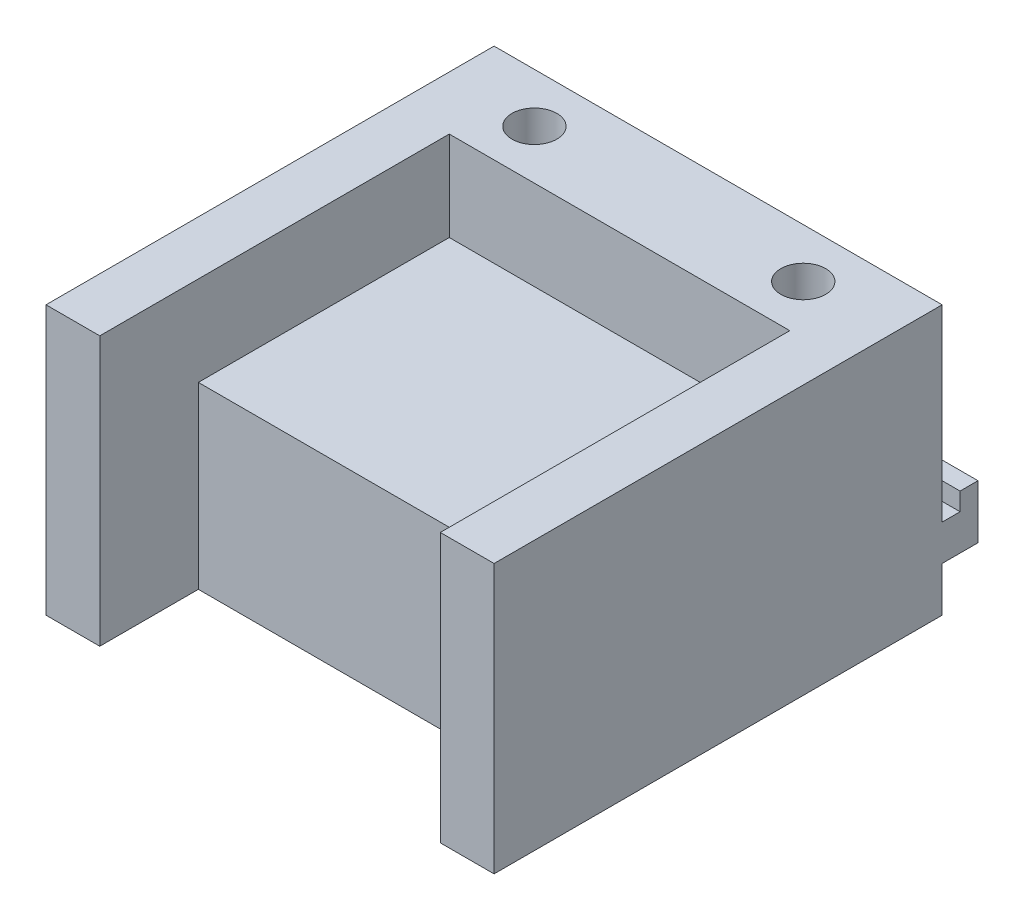
from build123d import *

# Parameters (mm, degrees)
SKETCH1_W                       = 25
SKETCH1_H                       = 25
BOSS_EXTRUDE1_DEPTH             = 15
SKETCH2_W                       = 19
SKETCH2_H                       = 14
CUT_EXTRUDE1_DEPTH              = 5
CUT_EXTRUDE2_DEPTH              = 24.184046239
CUT_EXTRUDE2_DEPTH_BACK         = 15
SKETCH3_W                       = 19
SKETCH3_H                       = 5.5
TAP_DRILL_FOR_M3X0_5_TAP1_D     = 2.5
TAP_DRILL_FOR_M3X0_5_TAP1_DEPTH = 5
TAP_DRILL_FOR_M3X0_5_TAP1_TIP   = 0.751075774
SKETCH6_W                       = 2
SKETCH6_H                       = 2
BOSS_EXTRUDE2_DEPTH             = 25
SKETCH7_W                       = 1
SKETCH7_H                       = 1
BOSS_EXTRUDE3_DEPTH             = 25


with BuildPart() as part:
    # Sketch1 → Boss-Extrude1 (new body)
    with BuildSketch(Plane(origin=(0, 0, 0), x_dir=(1, 0, 0), z_dir=(0, 1, 0))):
        Rectangle(SKETCH1_W, SKETCH1_H)
    extrude(amount=BOSS_EXTRUDE1_DEPTH)

    # Sketch2 → Cut-Extrude1 (cut)
    with BuildSketch(Plane(origin=(0, 15, 0), x_dir=(1, 0, 0), z_dir=(0, 1, 0))):
        Rectangle(SKETCH2_W, SKETCH2_H)
    extrude(amount=-CUT_EXTRUDE1_DEPTH, mode=Mode.SUBTRACT)

    # Sketch3 → Cut-Extrude2 (cut, two sides: drawn at the far end of the back side and taken through both)
    with BuildSketch(Plane(origin=(0, 15, 0), x_dir=(1, 0, 0), z_dir=(0, 1, 0)).offset(-CUT_EXTRUDE2_DEPTH_BACK)):
        with Locations((0, -9.75)):
            Rectangle(SKETCH3_W, SKETCH3_H)
    extrude(amount=CUT_EXTRUDE2_DEPTH + CUT_EXTRUDE2_DEPTH_BACK, mode=Mode.SUBTRACT)

    # Tap Drill for M3x0.5 Tap1
    with Locations(Plane(origin=(-7.5, 15, -9.75), x_dir=(0, 0, 1), z_dir=(0, 1, 0))):
        with Locations((0, 0), (0, 15)):
            Hole(TAP_DRILL_FOR_M3X0_5_TAP1_D / 2, depth=TAP_DRILL_FOR_M3X0_5_TAP1_DEPTH)
            with Locations((0, 0, -(TAP_DRILL_FOR_M3X0_5_TAP1_DEPTH + TAP_DRILL_FOR_M3X0_5_TAP1_TIP / 2))):  # 118° drill point
                Cone(0, TAP_DRILL_FOR_M3X0_5_TAP1_D / 2, TAP_DRILL_FOR_M3X0_5_TAP1_TIP, mode=Mode.SUBTRACT)

    # Sketch6 → Boss-Extrude2 (add)
    with BuildSketch(Plane(origin=(12.5, 0, 0), x_dir=(0, 0, -1), z_dir=(1, 0, 0))):
        with Locations((13.5, 3.5)):
            Rectangle(SKETCH6_W, SKETCH6_H)
    extrude(amount=-BOSS_EXTRUDE2_DEPTH)

    # Sketch7 → Boss-Extrude3 (add)
    with BuildSketch(Plane(origin=(12.5, 0, 0), x_dir=(0, 0, -1), z_dir=(1, 0, 0))):
        with Locations((14, 5)):
            Rectangle(SKETCH7_W, SKETCH7_H)
    extrude(amount=-BOSS_EXTRUDE3_DEPTH)


solid = part.part
